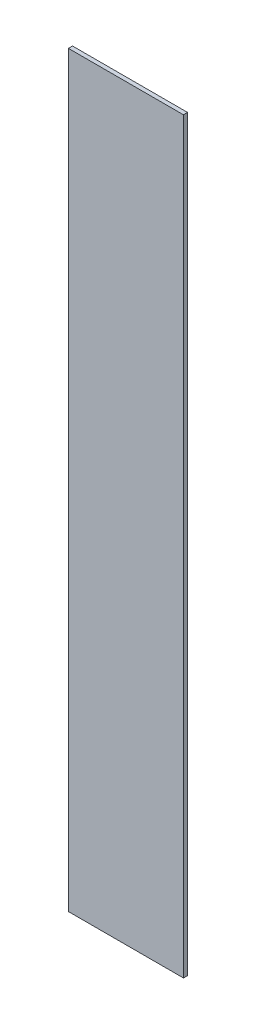
from build123d import *

# Parameters (mm, degrees)
PRESS_KOVA_KAPAGI_KULP_CUKURU_1_START = 26
SKETCH1_W                             = 28
SKETCH1_H                             = 182
PRESS_KOVA_KAPAGI_KULP_CUKURU_1_DEPTH = 1


with BuildPart() as part:
    # Sketch1 → PRESS_kova_kapagi_kulp_cukuru_1 (new body)
    with BuildSketch(Plane.XY.offset(PRESS_KOVA_KAPAGI_KULP_CUKURU_1_START)):
        with Locations((307, 1560)):
            Rectangle(SKETCH1_W, SKETCH1_H)
    extrude(amount=PRESS_KOVA_KAPAGI_KULP_CUKURU_1_DEPTH)


solid = part.part
